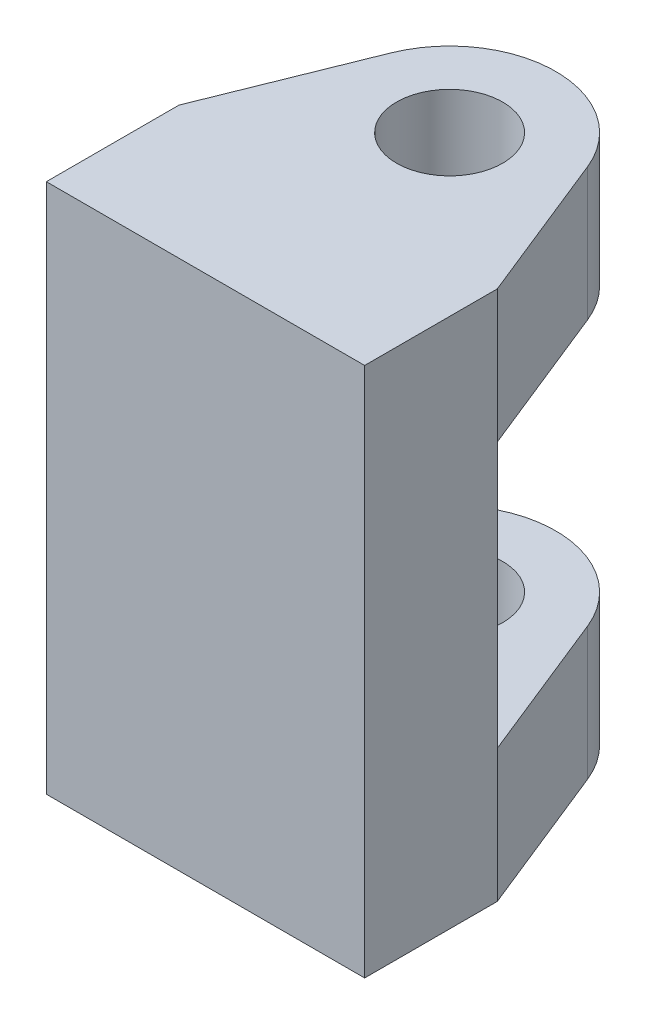
from build123d import *

# Parameters (mm, degrees)
SKETCH1_W           = 12
SKETCH1_H           = 20
BOSS_EXTRUDE1_DEPTH = 5
SKETCH2_R           = 2
BOSS_EXTRUDE2_DEPTH = 5


with BuildPart() as part:
    # Sketch1 → Boss-Extrude1 (new body)
    with BuildSketch(Plane.XY):
        Rectangle(SKETCH1_W, SKETCH1_H)
    extrude(amount=BOSS_EXTRUDE1_DEPTH)

    # Sketch2 → Boss-Extrude2 (add)
    with BuildSketch(Plane(origin=(0, 10, 0), x_dir=(1, 0, 0), z_dir=(0, 1, 0))):
        with BuildLine():
            Line((-6, 0), (-3.711490956, 5.694454764))
            ThreePointArc((-3.711490956, 5.694454764), (0, 8.202866725), (3.711490956, 5.694454764))
            Line((3.711490956, 5.694454764), (6, 0))
            Line((6, 0), (-6, 0))
        make_face()
        with Locations(Location((0, 4.202866725, 0), (0, 0, 270))):
            Circle(SKETCH2_R, mode=Mode.SUBTRACT)
    boss_extrude2 = extrude(amount=-BOSS_EXTRUDE2_DEPTH)

    # Mirror1: Boss-Extrude2 across plane
    add(boss_extrude2.mirror(Plane.ZX))


solid = part.part
